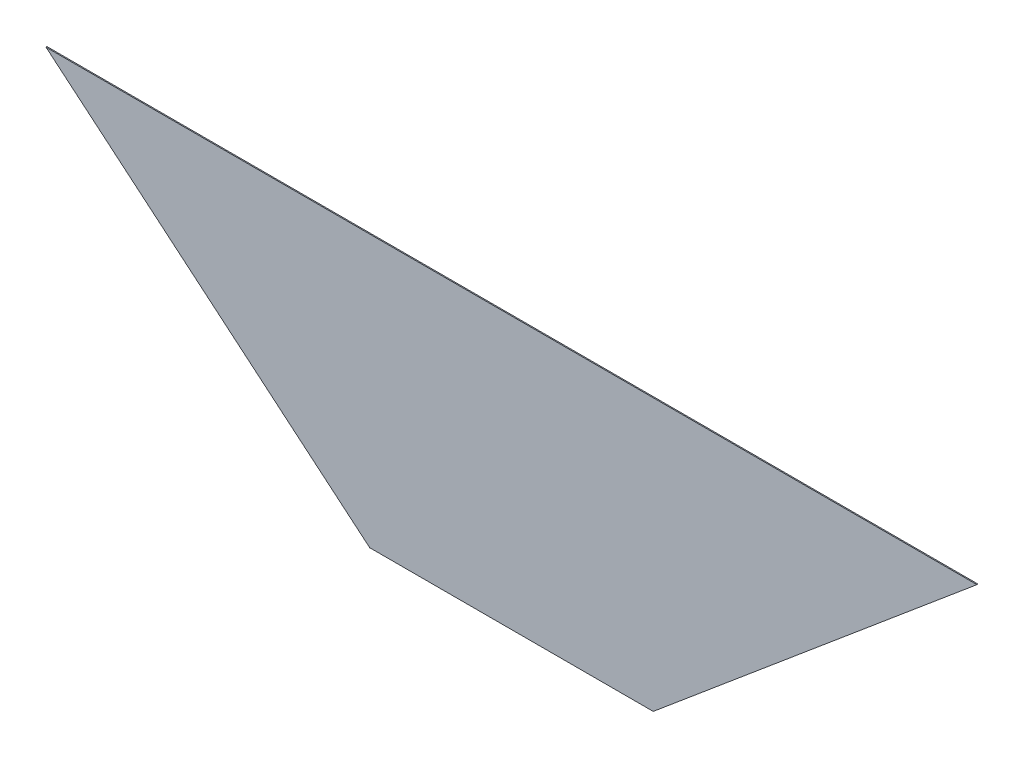
from build123d import *

# Parameters (mm, degrees)
SALIENTE_EXTRUIR1_DEPTH = 2.9


with BuildPart() as part:
    # Croquis1 → Saliente-Extruir1 (new body)
    with BuildSketch(Plane.XY):
        Polygon((0, 0), (790.88, 0), (1694.002790004, 757.81), (395.44, 757.81), (-903.122790004, 757.81), align=None)
    extrude(amount=SALIENTE_EXTRUIR1_DEPTH)


solid = part.part
